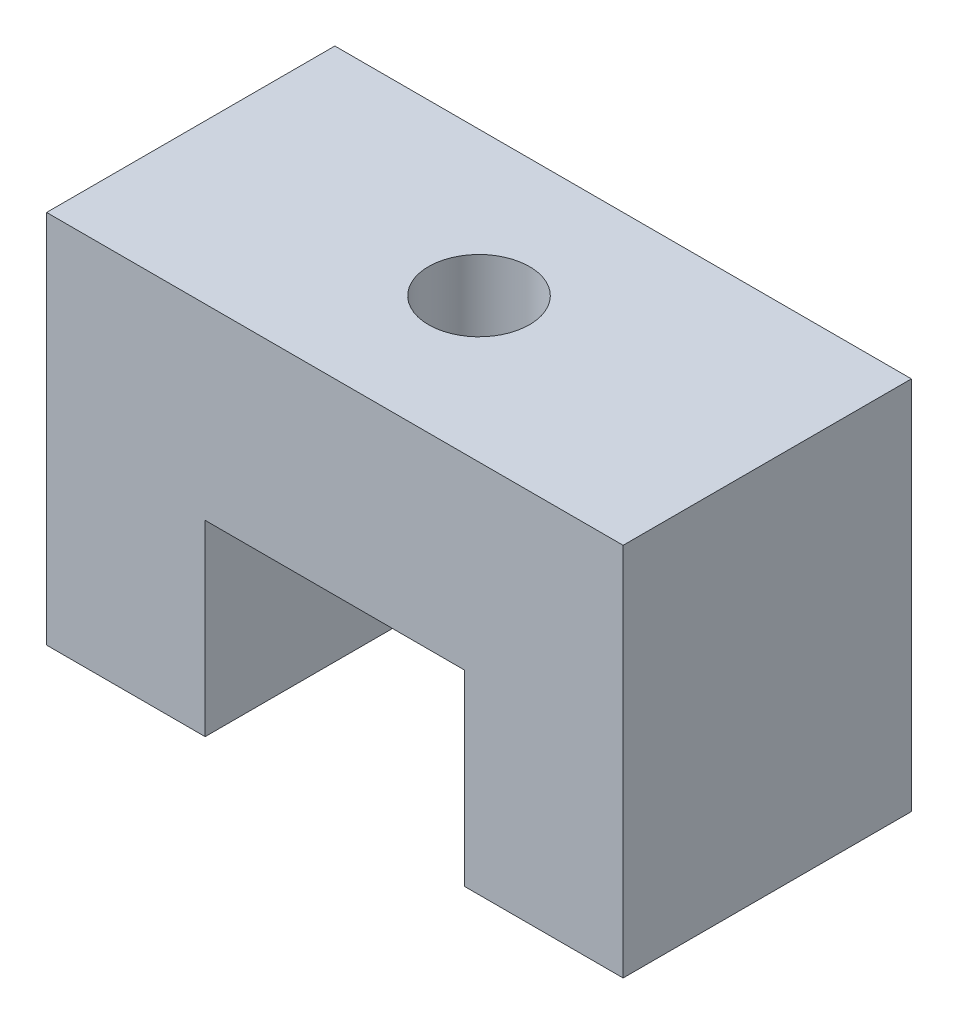
from build123d import *

# Parameters (mm, degrees)
EXTRUDE_1_DEPTH          = 5
CUT_EXTRUDE_1_DEPTH      = 18.146428199
CUT_EXTRUDE_1_DEPTH_BACK = 18.146428199
SKETCH_2_R               = 1.75


with BuildPart() as part:
    # 草图1 → 凸台-拉伸1 (new, symmetric)
    with BuildSketch(Plane.XY):
        Polygon((10, 6.5), (-10, 6.5), (-10, -6.5), (-4.5, -6.5), (-4.5, 0), (4.5, 0), (4.5, -6.5), (10, -6.5), align=None)
    extrude(amount=EXTRUDE_1_DEPTH, both=True)

    # 草图2 → 切除-拉伸1 (cut, two sides: drawn at the far end of the back side and taken through both)
    with BuildSketch(Plane(origin=(0, 6.5, 0), x_dir=(1, 0, 0), z_dir=(0, 1, 0)).offset(-CUT_EXTRUDE_1_DEPTH_BACK)):
        with Locations(Location((0, 0, 0), (0, 0, 270))):
            Circle(SKETCH_2_R)
    extrude(amount=CUT_EXTRUDE_1_DEPTH + CUT_EXTRUDE_1_DEPTH_BACK, mode=Mode.SUBTRACT)


solid = part.part
